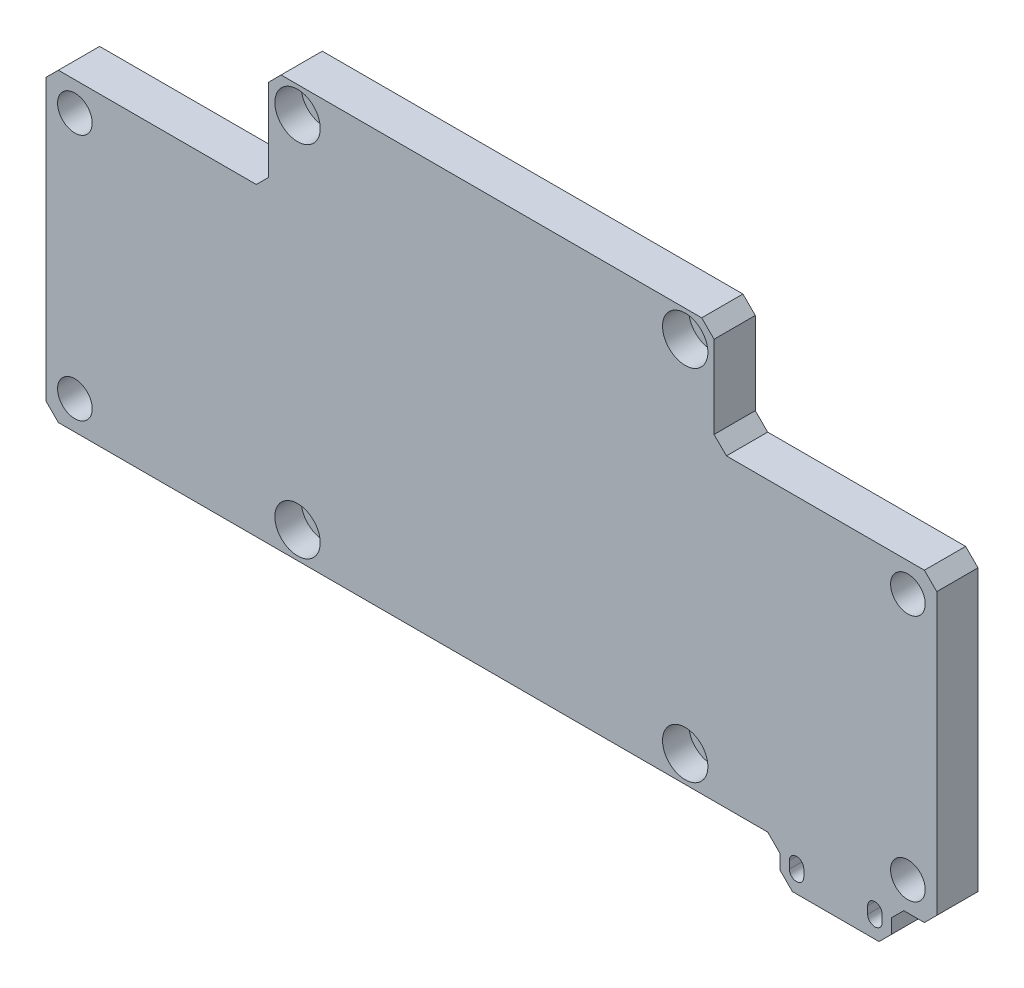
from build123d import *

# Parameters (mm, degrees)
SKIZZE1_W                                            = 216
SKIZZE1_H                                            = 100
AUFSATZ_LINEAR_AUSTRAGEN1_DEPTH                      = 10
STIRNSENKUNG_F_R_M6_ZYLINDERSCHRAUBE_MIT_D           = 6.6
STIRNSENKUNG_F_R_M6_ZYLINDERSCHRAUBE_MIT_DEPTH       = 15
STIRNSENKUNG_F_R_M6_ZYLINDERSCHRAUBE_MIT_CBORE_D     = 11
STIRNSENKUNG_F_R_M6_ZYLINDERSCHRAUBE_MIT_CBORE_DEPTH = 6.4
STIRNSENKUNG_F_R_M6_ZYLINDERSCHRAUBE_MIT_TIP         = 1.982840043
CBORE_FOR_M6_HEX_SOCKET_HEAD_CAP_SCREW1_D            = 6.6
CBORE_FOR_M6_HEX_SOCKET_HEAD_CAP_SCREW1_DEPTH        = 15
CBORE_FOR_M6_HEX_SOCKET_HEAD_CAP_SCREW1_CBORE_D      = 11
CBORE_FOR_M6_HEX_SOCKET_HEAD_CAP_SCREW1_CBORE_DEPTH  = 6.4
CBORE_FOR_M6_HEX_SOCKET_HEAD_CAP_SCREW1_TIP          = 1.982840043
M8_CLEARANCE_HOLE1_D                                 = 8.4
M8_CLEARANCE_HOLE1_DEPTH                             = 17
M8_CLEARANCE_HOLE1_TIP                               = 2.5236146
SKIZZE18_W                                           = 54
SKIZZE18_H                                           = 26
SCHNITT_LINEAR_AUSTRAGEN1_DEPTH                      = 15
SKETCH1_W                                            = 27
SKETCH1_H                                            = 10
BOSS_EXTRUDE1_DEPTH                                  = 9.5
CUT_EXTRUDE1_DEPTH                                   = 10
LPATTERN1_COUNT                                      = 2
LPATTERN1_PITCH                                      = 19
CUT_EXTRUDE2_START                                   = -10
CUT_EXTRUDE2_DEPTH                                   = 3
LPATTERN2_COUNT                                      = 2
LPATTERN2_PITCH                                      = 19
MIRROR1_COPY_1_DEPTH                                 = 10
MIRROR1_START                                        = -10
MIRROR1_COPY_2_DEPTH                                 = 3
SKETCH5_W                                            = 27
SKETCH5_H                                            = 9.5
CUT_EXTRUDE3_DEPTH                                   = 10
CHAMFER4_SIZE                                        = 3
CHAMFER5_SIZE                                        = 3


with BuildPart() as part:
    # Skizze1 → Aufsatz-Linear austragen1 (new body)
    with BuildSketch(Plane.XY):
        Rectangle(SKIZZE1_W, SKIZZE1_H)
    extrude(amount=AUFSATZ_LINEAR_AUSTRAGEN1_DEPTH)

    # Stirnsenkung für M6 Zylinderschraube mit Innensechskant1
    with Locations(Plane.XY.offset(10)):
        with Locations((-47, -43.5), (47, -43.5)):
            CounterBoreHole(STIRNSENKUNG_F_R_M6_ZYLINDERSCHRAUBE_MIT_D / 2, STIRNSENKUNG_F_R_M6_ZYLINDERSCHRAUBE_MIT_CBORE_D / 2, STIRNSENKUNG_F_R_M6_ZYLINDERSCHRAUBE_MIT_CBORE_DEPTH, depth=STIRNSENKUNG_F_R_M6_ZYLINDERSCHRAUBE_MIT_DEPTH)
            with Locations((0, 0, -(STIRNSENKUNG_F_R_M6_ZYLINDERSCHRAUBE_MIT_DEPTH + STIRNSENKUNG_F_R_M6_ZYLINDERSCHRAUBE_MIT_TIP / 2))):  # 118° drill point
                Cone(0, STIRNSENKUNG_F_R_M6_ZYLINDERSCHRAUBE_MIT_D / 2, STIRNSENKUNG_F_R_M6_ZYLINDERSCHRAUBE_MIT_TIP, mode=Mode.SUBTRACT)

    # CBORE for M6 Hex Socket Head Cap Screw1
    with Locations(Plane.XY.offset(10)):
        with Locations((-47, 43.5), (47, 43.5)):
            CounterBoreHole(CBORE_FOR_M6_HEX_SOCKET_HEAD_CAP_SCREW1_D / 2, CBORE_FOR_M6_HEX_SOCKET_HEAD_CAP_SCREW1_CBORE_D / 2, CBORE_FOR_M6_HEX_SOCKET_HEAD_CAP_SCREW1_CBORE_DEPTH, depth=CBORE_FOR_M6_HEX_SOCKET_HEAD_CAP_SCREW1_DEPTH)
            with Locations((0, 0, -(CBORE_FOR_M6_HEX_SOCKET_HEAD_CAP_SCREW1_DEPTH + CBORE_FOR_M6_HEX_SOCKET_HEAD_CAP_SCREW1_TIP / 2))):  # 118° drill point
                Cone(0, CBORE_FOR_M6_HEX_SOCKET_HEAD_CAP_SCREW1_D / 2, CBORE_FOR_M6_HEX_SOCKET_HEAD_CAP_SCREW1_TIP, mode=Mode.SUBTRACT)

    # M8 Clearance Hole1
    with Locations(Plane.XY.offset(10)):
        with Locations((-101, 17), (-101, -43), (101, 17), (101, -43)):
            Hole(M8_CLEARANCE_HOLE1_D / 2, depth=M8_CLEARANCE_HOLE1_DEPTH)
            with Locations((0, 0, -(M8_CLEARANCE_HOLE1_DEPTH + M8_CLEARANCE_HOLE1_TIP / 2))):  # 118° drill point
                Cone(0, M8_CLEARANCE_HOLE1_D / 2, M8_CLEARANCE_HOLE1_TIP, mode=Mode.SUBTRACT)

    # Skizze18 → Schnitt-Linear austragen1 (cut)
    with BuildSketch(Plane.XY.offset(10)):
        with Locations((-81, 37)):
            Rectangle(SKIZZE18_W, SKIZZE18_H)
    schnitt_linear_austragen1 = extrude(amount=-SCHNITT_LINEAR_AUSTRAGEN1_DEPTH, mode=Mode.SUBTRACT)

    # Spiegeln1: Schnitt-Linear austragen1 across plane
    add(schnitt_linear_austragen1.mirror(Plane(origin=(0, 0, 0), x_dir=(0, 0, 1), z_dir=(1, 0, 0))), mode=Mode.SUBTRACT)

    # Sketch1 → Boss-Extrude1 (add)
    with BuildSketch(Plane(origin=(0, 24, 0), x_dir=(1, 0, 0), z_dir=(0, 1, 0))):
        with Locations((83.5, -5)):
            Rectangle(SKETCH1_W, SKETCH1_H)
    boss_extrude1 = extrude(amount=BOSS_EXTRUDE1_DEPTH)

    # Sketch3 → Cut-Extrude1 (cut)
    with BuildSketch(Plane(origin=(0, 0, 0), x_dir=(-1, 0, 0), z_dir=(0, 0, -1))):
        with BuildLine():
            Line((-91.25, 29.15), (-91.25, 27.35))
            ThreePointArc((-91.25, 27.35), (-93, 25.6), (-94.75, 27.35))
            Line((-94.75, 27.35), (-94.75, 29.15))
            ThreePointArc((-94.75, 29.15), (-93, 30.9), (-91.25, 29.15))
        make_face()
    cut_extrude1 = extrude(amount=-CUT_EXTRUDE1_DEPTH, mode=Mode.SUBTRACT)

    # LPattern1: Cut-Extrude1 ×2
    with Locations(*[(-i * LPATTERN1_PITCH, 0, 0) for i in range(1, LPATTERN1_COUNT)]):
        add(cut_extrude1, mode=Mode.SUBTRACT)

    # Sketch4 → Cut-Extrude2 (cut)
    with BuildSketch(Plane.XY.offset(10).offset(CUT_EXTRUDE2_START)):
        Polygon((74, 32.383161507), (71.2, 30.766580754), (71.2, 28.375279034), (71.2, 25.733419246), (74, 24.116838493), (76.8, 25.733419246), (76.8, 28.372780006), (76.8, 30.766580754), align=None)
    cut_extrude2 = extrude(amount=CUT_EXTRUDE2_DEPTH, mode=Mode.SUBTRACT)

    # LPattern2: Cut-Extrude2 ×2
    with Locations(*[(i * LPATTERN2_PITCH, 0, 0) for i in range(1, LPATTERN2_COUNT)]):
        add(cut_extrude2, mode=Mode.SUBTRACT)

    # Mirror1: Boss-Extrude1, Cut-Extrude1, Cut-Extrude2 across plane
    add(boss_extrude1.mirror(Plane.ZX.offset(-13)))
    add(cut_extrude1.mirror(Plane.ZX.offset(-13)), mode=Mode.SUBTRACT)
    add(cut_extrude2.mirror(Plane.ZX.offset(-13)), mode=Mode.SUBTRACT)

    # Mirror1 copy 1 sketch → Mirror1 copy 1 (cut)
    with BuildSketch(Plane(origin=(-19, -26, 0), x_dir=(-1, 0, 0), z_dir=(0, 0, -1))):
        with BuildLine():
            Line((-91.25, -29.15), (-91.25, -27.35))
            ThreePointArc((-91.25, -27.35), (-93, -25.6), (-94.75, -27.35))
            Line((-94.75, -27.35), (-94.75, -29.15))
            ThreePointArc((-94.75, -29.15), (-93, -30.9), (-91.25, -29.15))
        make_face()
    extrude(amount=-MIRROR1_COPY_1_DEPTH, mode=Mode.SUBTRACT)

    # Mirror1 copy 2 sketch → Mirror1 copy 2 (cut)
    with BuildSketch(Plane(origin=(19, -26, 10), x_dir=(1, 0, 0), z_dir=(0, 0, 1)).offset(MIRROR1_START)):
        Polygon((74, -32.383161507), (71.2, -30.766580754), (71.2, -28.375279034), (71.2, -25.733419246), (74, -24.116838493), (76.8, -25.733419246), (76.8, -28.372780006), (76.8, -30.766580754), align=None)
    extrude(amount=MIRROR1_COPY_2_DEPTH, mode=Mode.SUBTRACT)

    # Sketch5 → Cut-Extrude3 (cut)
    with BuildSketch(Plane.XY.offset(10)):
        with Locations((83.5, 28.75)):
            Rectangle(SKETCH5_W, SKETCH5_H)
    extrude(amount=-CUT_EXTRUDE3_DEPTH, mode=Mode.SUBTRACT)

    # Chamfer4
    chamfer4_edges = [part.edges().sort_by_distance(p)[0] for p in [
        (97, -59.5, 5),
        (70, -59.5, 5),
        (97, -50, 5),
        (70, -50, 5),
        (-54, 24, 5),
        (54, 24, 5),
    ]]
    chamfer(chamfer4_edges, length=CHAMFER4_SIZE)

    # Chamfer5
    chamfer5_edges = [part.edges().sort_by_distance(p)[0] for p in [
        (108, -50, 5),
        (-108, 24, 5),
        (-108, -50, 5),
        (-54, 50, 5),
        (108, 24, 5),
        (54, 50, 5),
    ]]
    chamfer(chamfer5_edges, length=CHAMFER5_SIZE)


solid = part.part
